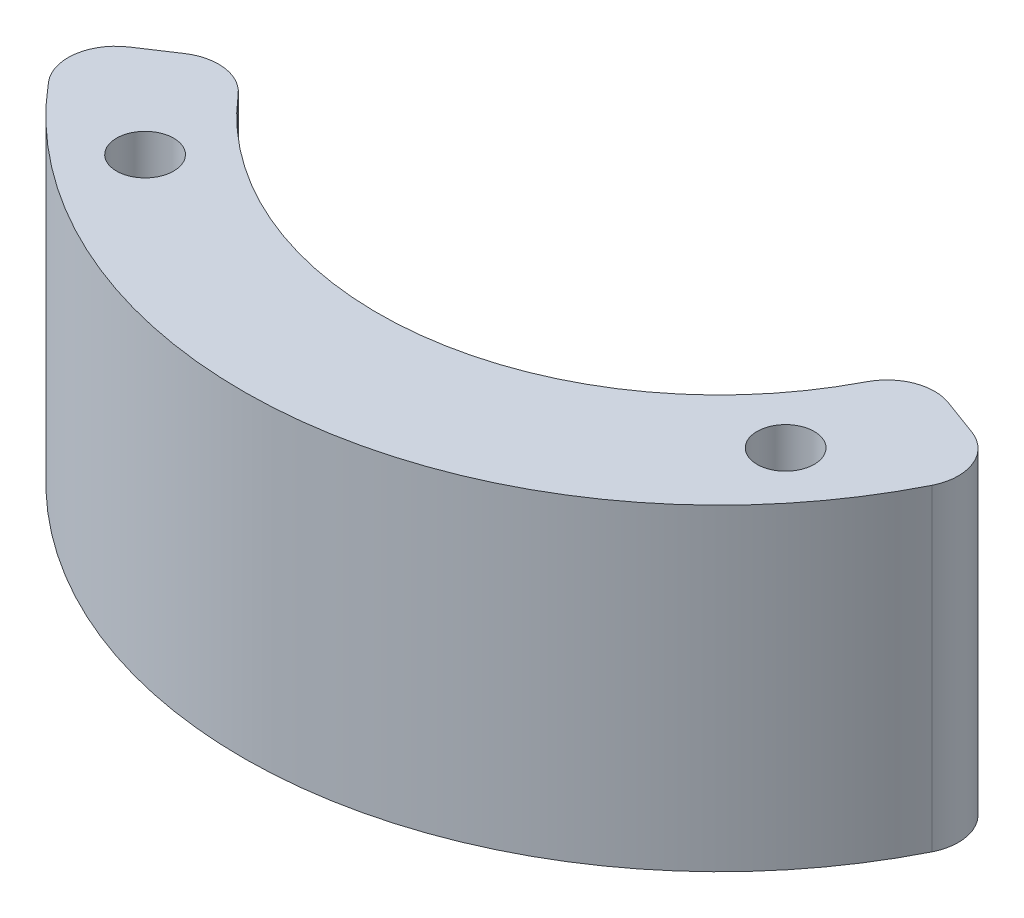
from build123d import *

# Parameters (mm, degrees)
SKETCH1_R           = 1.8
BOSS_EXTRUDE1_DEPTH = 20
FILLET1_R           = 3


with BuildPart() as part:
    # Sketch1 → Boss-Extrude1 (new body)
    with BuildSketch(Plane(origin=(0, 0, 0), x_dir=(1, 0, 0), z_dir=(0, 1, 0))):
        with BuildLine():
            Line((-25.017964349, -16.556009779), (-17.929541117, -11.865140342))
            ThreePointArc((-17.929541117, -11.865140342), (2.486287007, -21.355757465), (20.175789947, -7.428828979))
            Line((20.175789947, -7.428828979), (28.152265043, -10.365807878))
            ThreePointArc((28.152265043, -10.365807878), (3.469237684, -29.798731347), (-25.017964349, -16.556009779))
        make_face()
        with Locations(Location((20.175789947, -16, 0), (0, 0, 270))):
            Circle(SKETCH1_R, mode=Mode.SUBTRACT)
        with Locations(Location((-16, -20.175789947, 0), (0, 0, 270))):
            Circle(SKETCH1_R, mode=Mode.SUBTRACT)
    extrude(amount=BOSS_EXTRUDE1_DEPTH)

    # Fillet1
    fillet1_edges = [part.edges().sort_by_distance(p)[0] for p in [
        (-25.017964349, 10, 16.556009779),
        (-17.929541117, 10, 11.865140342),
        (20.175789947, 10, 7.428828979),
        (28.152265043, 10, 10.365807878),
    ]]
    fillet(fillet1_edges, radius=FILLET1_R)


solid = part.part
